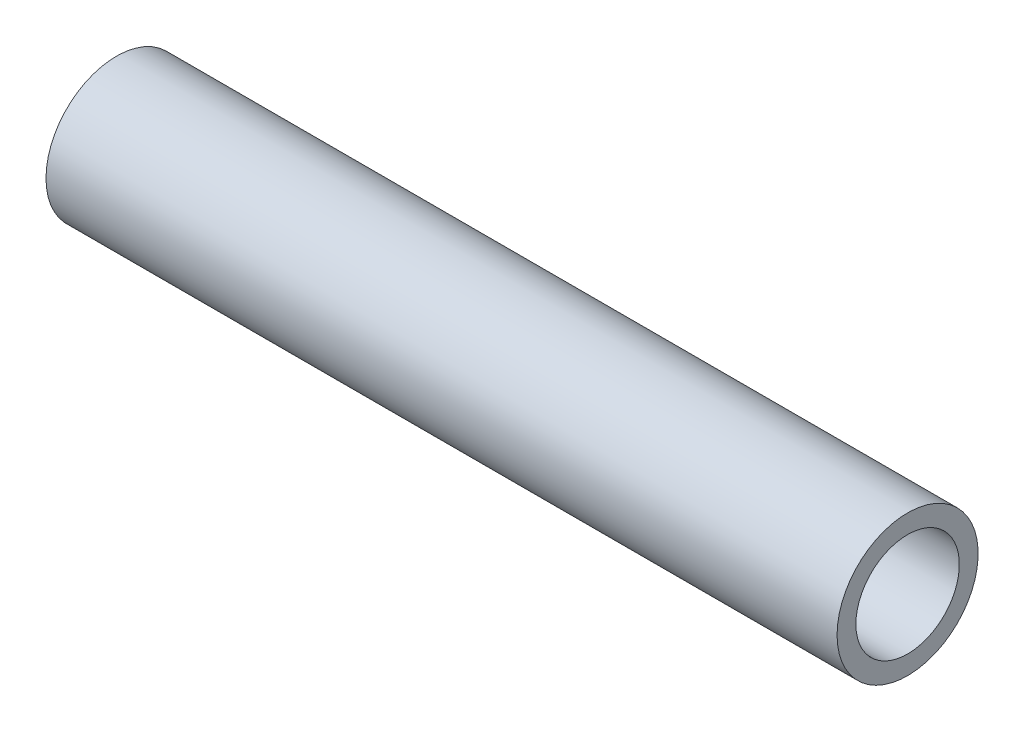
from build123d import *

# Parameters (mm, degrees)
AXIAL_PROFILE_MM_W = 25.235689014
AXIAL_PROFILE_MM_H = 0.6


with BuildPart() as part:
    # Axial profile (mm) → Full revolution (revolve)
    with BuildSketch(Plane.XY, mode=Mode.PRIVATE) as full_revolution_sk:
        with Locations((12.617844507, 1.95)):
            Rectangle(AXIAL_PROFILE_MM_W, AXIAL_PROFILE_MM_H)
    revolve(full_revolution_sk.sketch.rotate(Axis((-110, 0, 0), (1, 0, 0)), 90), axis=Axis((-110, 0, 0), (1, 0, 0)))


solid = part.part
